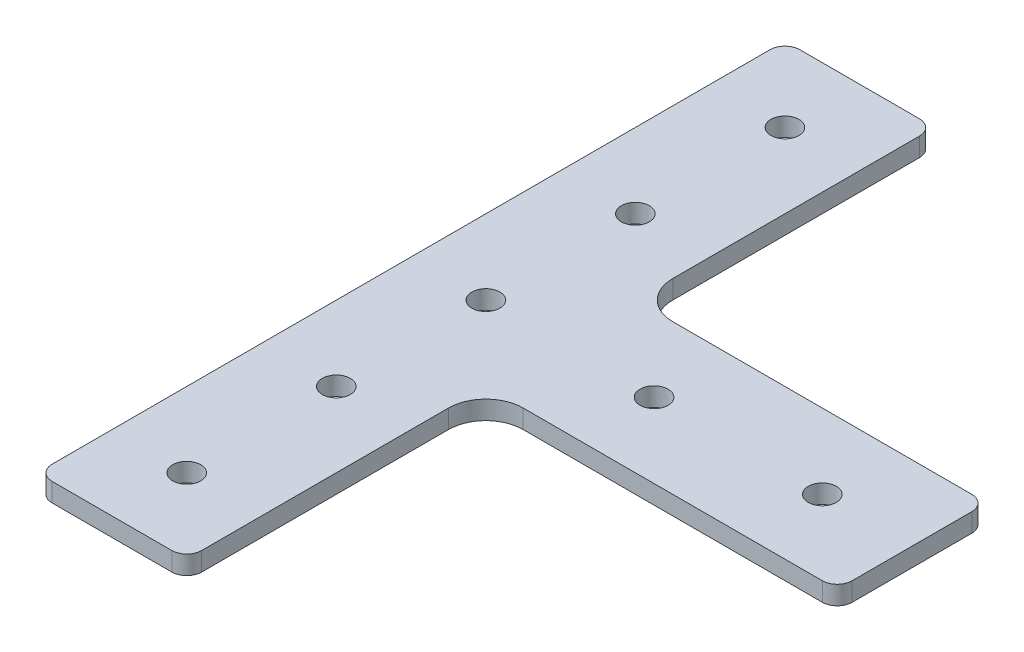
from build123d import *

# Parameters (mm, degrees)
SKETCH1_R           = 2.38125
BOSS_EXTRUDE1_DEPTH = 3.175


with BuildPart() as part:
    # Sketch1 → Boss-Extrude1 (new body)
    with BuildSketch(Plane(origin=(0, 0, 0), x_dir=(1, 0, 0), z_dir=(0, 1, 0))):
        with BuildLine():
            Line((-12.7, -38.1), (-12.7, -35.56))
            Line((-12.7, -35.56), (-12.7, 35.56))
            ThreePointArc((-12.7, 35.56), (-11.956051224, 37.356051224), (-10.16, 38.1))
            Line((-10.16, 38.1), (10.16, 38.1))
            ThreePointArc((10.16, 38.1), (11.956051224, 37.356051224), (12.7, 35.56))
            Line((12.7, 35.56), (12.7, -6.35))
            ThreePointArc((12.7, -6.35), (14.559871939, -10.840128061), (19.05, -12.7))
            Line((19.05, -12.7), (69.85, -12.7))
            ThreePointArc((69.85, -12.7), (71.646051224, -13.443948776), (72.39, -15.24))
            Line((72.39, -15.24), (72.39, -35.56))
            ThreePointArc((72.39, -35.56), (71.646051224, -37.356051224), (69.85, -38.1))
            Line((69.85, -38.1), (19.05, -38.1))
            ThreePointArc((19.05, -38.1), (14.559871939, -39.959871939), (12.7, -44.45))
            Line((12.7, -44.45), (12.7, -86.36))
            ThreePointArc((12.7, -86.36), (11.956051224, -88.156051224), (10.16, -88.9))
            Line((10.16, -88.9), (-10.16, -88.9))
            ThreePointArc((-10.16, -88.9), (-11.956051224, -88.156051224), (-12.7, -86.36))
            Line((-12.7, -86.36), (-12.7, -38.1))
        make_face()
        with Locations(Location((0, -25.4, 0), (0, 0, 270))):
            Circle(SKETCH1_R, mode=Mode.SUBTRACT)
        with Locations(Location((0, 0, 0), (0, 0, 270))):
            Circle(SKETCH1_R, mode=Mode.SUBTRACT)
        with Locations(Location((0, 25.4, 0), (0, 0, 270))):
            Circle(SKETCH1_R, mode=Mode.SUBTRACT)
        with Locations(Location((28.575, -25.4, 0), (0, 0, 270))):
            Circle(SKETCH1_R, mode=Mode.SUBTRACT)
        with Locations(Location((57.15, -25.4, 0), (0, 0, 270))):
            Circle(SKETCH1_R, mode=Mode.SUBTRACT)
        with Locations(Location((0, -76.2, 0), (0, 0, 90))):
            Circle(SKETCH1_R, mode=Mode.SUBTRACT)
        with Locations(Location((0, -50.8, 0), (0, 0, 90))):
            Circle(SKETCH1_R, mode=Mode.SUBTRACT)
    extrude(amount=BOSS_EXTRUDE1_DEPTH)


solid = part.part
